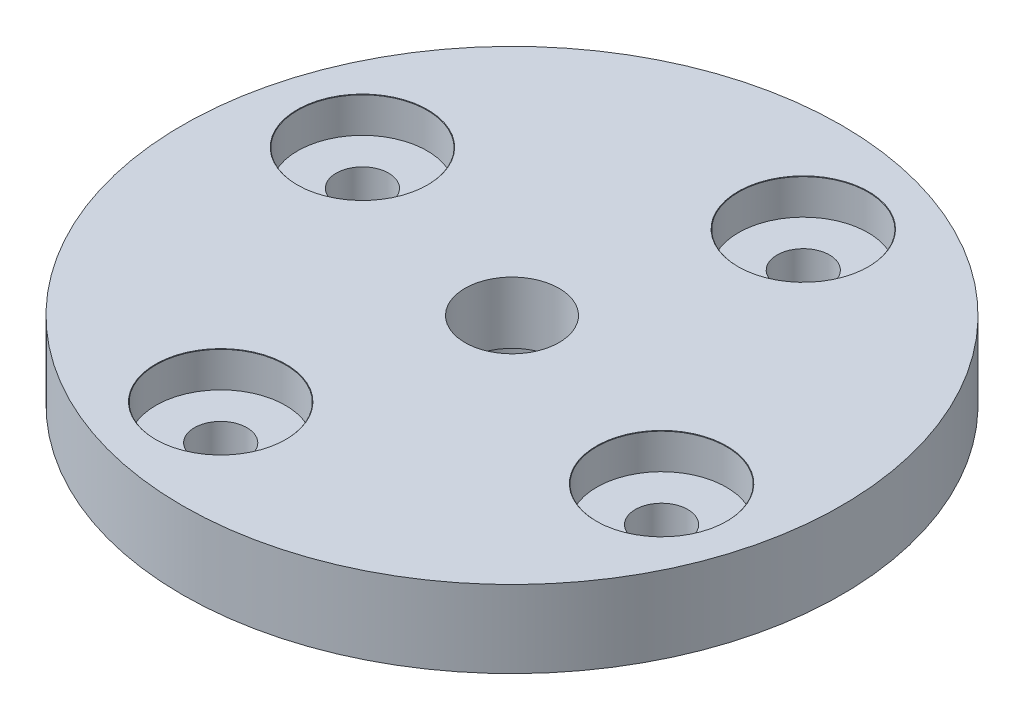
from build123d import *

# Parameters (mm, degrees)
CBORE_FOR_M3_HEX_HEAD_MACHINE_SCREW1_AT_COUNT = 2
CBORE_FOR_M3_HEX_HEAD_MACHINE_SCREW1_AT_PITCH = 21.213203436
CBORE_FOR_M3_HEX_HEAD_MACHINE_SCREW1_2_COUNT  = 2
CBORE_FOR_M3_HEX_HEAD_MACHINE_SCREW1_2_PITCH  = 21.213203436
CBORE_FOR_M3_HEX_HEAD_MACHINE_SCREW1_3_COUNT  = 2
CBORE_FOR_M3_HEX_HEAD_MACHINE_SCREW1_3_PITCH  = 30


with BuildPart() as part:
    # Sketch1 → Revolve1 (revolve)
    with BuildSketch(Plane.XY, mode=Mode.PRIVATE) as revolve1_sk:
        Polygon((21.35, 0), (21.35, 5), (3.048, 5), (3.048, 1), (4, 1), (4, 0), align=None)
    revolve(revolve1_sk.sketch.rotate(Axis((0, 0, 0), (0, 1, 0)), 90), axis=Axis((0, 0, 0), (0, 1, 0)))

    # Sketch3 → CBORE for M3 Hex Head Machine Screw1 (revolve, cut)
    with BuildSketch(Plane(origin=(4.590221075, 5, -14.280401622), x_dir=(0, 0, 1), z_dir=(1, 0, 0))):
        Polygon((0, 0), (0, 5), (1.7, 5), (1.7, 2.3), (4.2, 2.3), (4.2, 0.025), (4.225, 0), align=None)
    cbore_for_m3_hex_head_machine_screw1 = revolve(axis=Axis((4.590221075, 11.35, -14.280401622), (0, -1, 0)), mode=Mode.SUBTRACT)

    # CBORE for M3 Hex Head Machine Screw1 at: CBORE for M3 Hex Head Machine Screw1 ×2
    with Locations(*[Vector(-0.8895696849339428, 0, 0.4567994917319041) * (i * CBORE_FOR_M3_HEX_HEAD_MACHINE_SCREW1_AT_PITCH) for i in range(1, CBORE_FOR_M3_HEX_HEAD_MACHINE_SCREW1_AT_COUNT)]):
        add(cbore_for_m3_hex_head_machine_screw1, mode=Mode.SUBTRACT)

    # CBORE for M3 Hex Head Machine Screw1 2: CBORE for M3 Hex Head Machine Screw1 ×2
    with Locations(*[Vector(0.4567994917319041, 0, 0.8895696849339427) * (i * CBORE_FOR_M3_HEX_HEAD_MACHINE_SCREW1_2_PITCH) for i in range(1, CBORE_FOR_M3_HEX_HEAD_MACHINE_SCREW1_2_COUNT)]):
        add(cbore_for_m3_hex_head_machine_screw1, mode=Mode.SUBTRACT)

    # CBORE for M3 Hex Head Machine Screw1 3: CBORE for M3 Hex Head Machine Screw1 ×2
    with Locations(*[Vector(-0.3060147383085738, 0, 0.9520267748009691) * (i * CBORE_FOR_M3_HEX_HEAD_MACHINE_SCREW1_3_PITCH) for i in range(1, CBORE_FOR_M3_HEX_HEAD_MACHINE_SCREW1_3_COUNT)]):
        add(cbore_for_m3_hex_head_machine_screw1, mode=Mode.SUBTRACT)


solid = part.part
